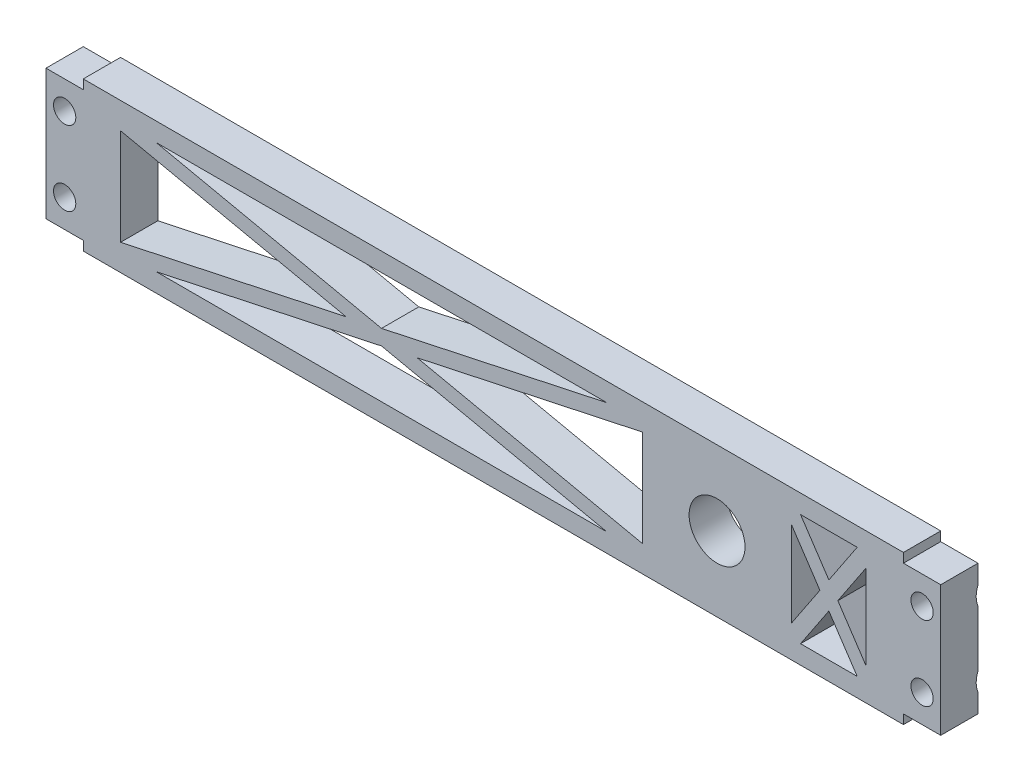
from build123d import *

# Parameters (mm, degrees)
SKETCH1_W                                         = 152.4
SKETCH1_H                                         = 25.4
SKETCH1_R                                         = 4.7625
BOSS_EXTRUDE1_DEPTH                               = 6.35
CSK_FOR_6_FLAT_HEAD_MACHINE_SCREW_100_D           = 3.7973
CSK_FOR_6_FLAT_HEAD_MACHINE_SCREW_100_CSINK_D     = 7.0866
CSK_FOR_6_FLAT_HEAD_MACHINE_SCREW_100_CSINK_ANGLE = 100
SKETCH5_W                                         = 6.35
SKETCH5_H                                         = 1.5875
CUT_EXTRUDE1_DEPTH                                = 116.178567885
MIRROR2_COPY_1_SKETCH_W                           = 6.35
MIRROR2_COPY_1_SKETCH_H                           = 1.5875
MIRROR2_COPY_1_DEPTH                              = 116.178567885
MIRROR2_COPY_2_SKETCH_W                           = 6.35
MIRROR2_COPY_2_SKETCH_H                           = 1.5875
MIRROR2_COPY_2_DEPTH                              = 116.178567885


with BuildPart() as part:
    # Sketch1 → Boss-Extrude1 (new body)
    with BuildSketch(Plane.XY):
        with Locations((-38.1, 0)):
            Rectangle(SKETCH1_W, SKETCH1_H)
        Polygon((-101.6, -8.226169089), (-101.6, 8.226169089), (-63.211210917, 0), align=None, mode=Mode.SUBTRACT)
        Polygon((-18.761210917, -9.525), (-95.538789083, -9.525), (-57.15, -1.298830911), align=None, mode=Mode.SUBTRACT)
        Polygon((-12.7, 8.226169089), (-12.7, -8.226169089), (-51.088789083, 0), align=None, mode=Mode.SUBTRACT)
        Polygon((-95.538789083, 9.525), (-18.761210917, 9.525), (-57.15, 1.298830911), align=None, mode=Mode.SUBTRACT)
        Polygon((14.22635004, 9.525), (23.87364996, 9.525), (19.05, 2.28952506), align=None, mode=Mode.SUBTRACT)
        Circle(SKETCH1_R, mode=Mode.SUBTRACT)
        Polygon((12.7, -7.23547494), (12.7, 7.23547494), (17.52364996, 0), align=None, mode=Mode.SUBTRACT)
        Polygon((23.87364996, -9.525), (14.22635004, -9.525), (19.05, -2.28952506), align=None, mode=Mode.SUBTRACT)
        Polygon((25.4, 7.23547494), (25.4, -7.23547494), (20.57635004, 0), align=None, mode=Mode.SUBTRACT)
    extrude(amount=BOSS_EXTRUDE1_DEPTH)

    # CSK for #6 Flat Head Machine Screw (100)1 (through all)
    with Locations(Plane(origin=(0, 0, 0), x_dir=(-1, 0, 0), z_dir=(0, 0, -1))):
        with Locations((-34.925, 6.35), (-34.925, -6.35), (111.125, -6.35), (111.125, 6.35)):
            CounterSinkHole(CSK_FOR_6_FLAT_HEAD_MACHINE_SCREW_100_D / 2, CSK_FOR_6_FLAT_HEAD_MACHINE_SCREW_100_CSINK_D / 2, counter_sink_angle=CSK_FOR_6_FLAT_HEAD_MACHINE_SCREW_100_CSINK_ANGLE)

    # Sketch5 → Cut-Extrude1 (cut, through all)
    with BuildSketch(Plane(origin=(0, 0, 0), x_dir=(-1, 0, 0), z_dir=(0, 0, -1))):
        with Locations((111.125, -11.90625)):
            Rectangle(SKETCH5_W, SKETCH5_H)
    cut_extrude1 = extrude(amount=-CUT_EXTRUDE1_DEPTH, mode=Mode.SUBTRACT)

    # Mirror1: Cut-Extrude1 across plane
    add(cut_extrude1.mirror(Plane.ZY.offset(38.1)), mode=Mode.SUBTRACT)

    # Mirror2 copy 1 sketch → Mirror2 copy 1 (cut, through all)
    with BuildSketch(Plane(origin=(-76.2, 0, 0), x_dir=(1, 0, 0), z_dir=(0, 0, -1))):
        with Locations((111.125, -11.90625)):
            Rectangle(MIRROR2_COPY_1_SKETCH_W, MIRROR2_COPY_1_SKETCH_H)
    extrude(amount=-MIRROR2_COPY_1_DEPTH, mode=Mode.SUBTRACT)

    # Mirror2 copy 2 sketch → Mirror2 copy 2 (cut, through all)
    with BuildSketch(Plane(origin=(0, 0, 0), x_dir=(-1, 0, 0), z_dir=(0, 0, -1))):
        with Locations((111.125, 11.90625)):
            Rectangle(MIRROR2_COPY_2_SKETCH_W, MIRROR2_COPY_2_SKETCH_H)
    extrude(amount=-MIRROR2_COPY_2_DEPTH, mode=Mode.SUBTRACT)


solid = part.part
